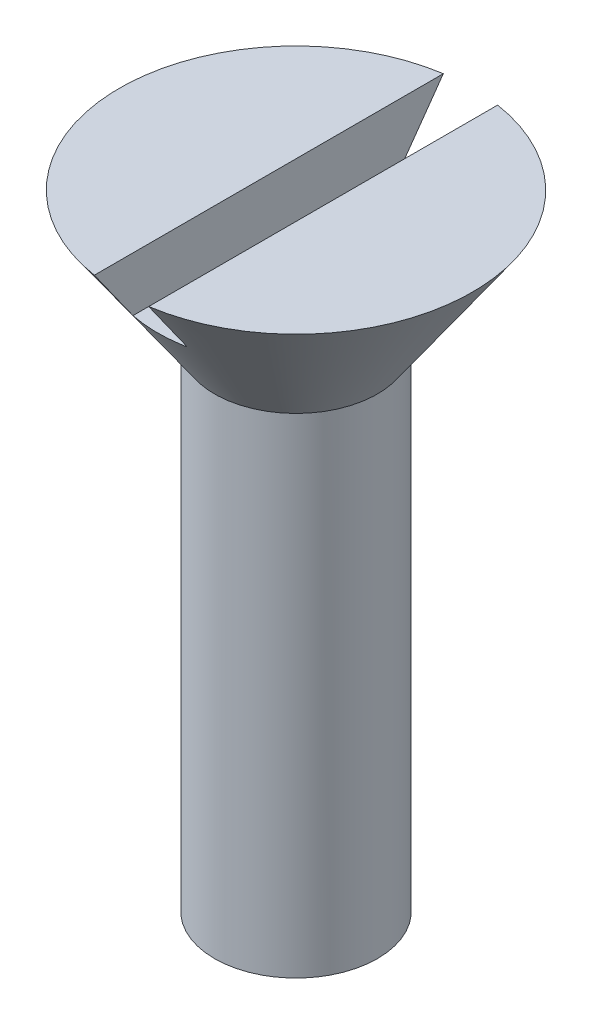
from build123d import *

# Parameters (mm, degrees)
CUT_EXTRUDE1_DEPTH      = 12
CUT_EXTRUDE1_DEPTH_BACK = 11
SKETCH4_W               = 2
SKETCH4_H               = 2


with BuildPart() as part:
    # Sketch1 → Revolve1 (revolve)
    with BuildSketch(Plane.XY, mode=Mode.PRIVATE) as revolve1_sk:
        Polygon((0, -7.771479045), (6.5, -7.771479045), (3, -12.771479045), (3, -30.771479045), (0, -32.503529853), align=None)
    revolve(revolve1_sk.sketch.rotate(Axis((0, -32.503529853, 0), (0, 1, 0)), 90), axis=Axis((0, -32.503529853, 0), (0, 1, 0)))

    # Sketch4 → Cut-Extrude1 (cut, two sides: drawn at the far end of the back side and taken through both)
    with BuildSketch(Plane.XY.offset(-CUT_EXTRUDE1_DEPTH_BACK)):
        with Locations((0, -8.771479045)):
            Rectangle(SKETCH4_W, SKETCH4_H)
    extrude(amount=CUT_EXTRUDE1_DEPTH + CUT_EXTRUDE1_DEPTH_BACK, mode=Mode.SUBTRACT)


solid = part.part
